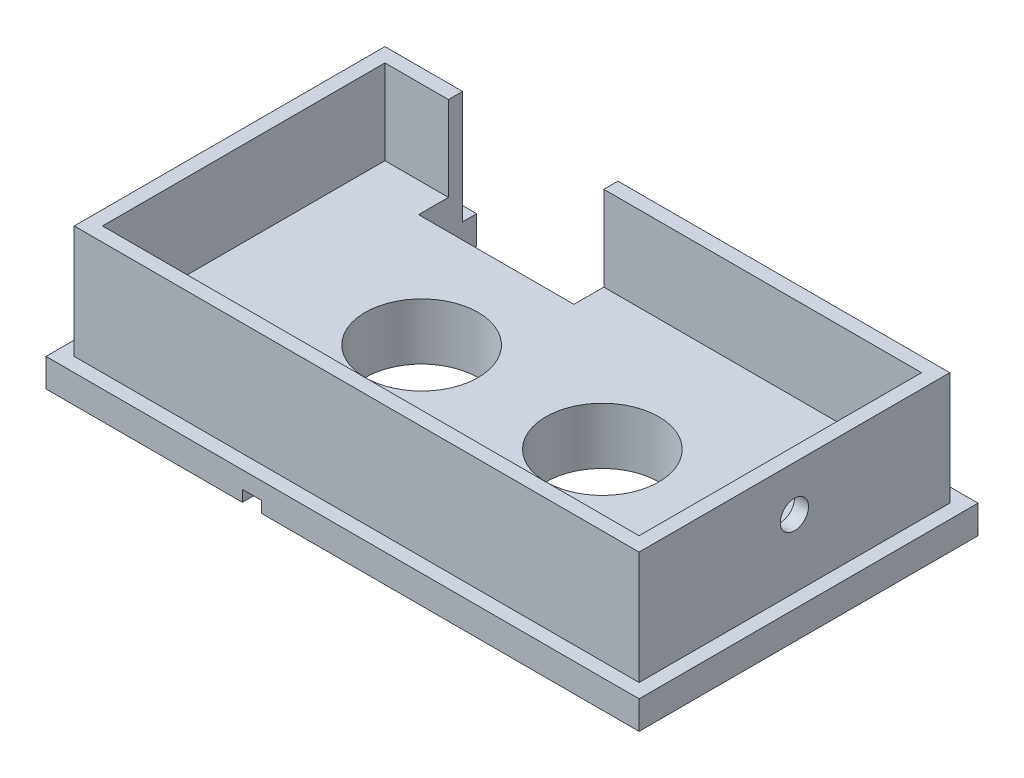
from build123d import *

# Parameters (mm, degrees)
SKETCH1_W           = 42
SKETCH1_H           = 24
BOSS_EXTRUDE1_DEPTH = 2
BOSS_EXTRUDE2_DEPTH = 8
CUT_EXTRUDE1_DEPTH  = 6
CUT_EXTRUDE2_REACH  = 51.396
SKETCH2_R           = 4
SKETCH3_W           = 3.111111111
SKETCH3_H           = 1.652777778
CUT_EXTRUDE3_DEPTH  = 0.8
CUT_EXTRUDE4_REACH  = 51.396
SKETCH4_W           = 11
SKETCH4_H           = 4.114457091
CUT_EXTRUDE5_REACH  = 50.549
SKETCH5_R           = 1


with BuildPart() as part:
    # Sketch1 → Boss-Extrude1 (new body)
    with BuildSketch(Plane(origin=(0, 0, 0), x_dir=(1, 0, 0), z_dir=(0, 1, 0))):
        with Locations((21, 12)):
            Rectangle(SKETCH1_W, SKETCH1_H)
    extrude(amount=BOSS_EXTRUDE1_DEPTH)

    # 3DSketch1 → Boss-Extrude2 (add)
    with BuildSketch(Plane(origin=(1, 2, -1), x_dir=(0.876215908676647, 0, -0.4819187497721558), z_dir=(0, -1, 0))):
        Polygon((0, 0), (35.048636347, 19.276749991), (45.650848842, 0), (10.602212495, -19.276749991), align=None)
    extrude(amount=-BOSS_EXTRUDE2_DEPTH)

    # 3DSketch2 → Cut-Extrude1 (cut)
    with BuildSketch(Plane(origin=(2, 10, -2), x_dir=(0.8849182223819825, 0, -0.4657464328326223), z_dir=(0, -1, 0))):
        Polygon((0, 0), (33.626892451, 17.698364448), (42.941821107, 0), (9.314928657, -17.698364448), align=None)
    extrude(amount=CUT_EXTRUDE1_DEPTH, mode=Mode.SUBTRACT)

    # Sketch2 → Cut-Extrude2 (cut, up to next)
    with BuildSketch(Plane.XZ, mode=Mode.PRIVATE) as cut_extrude2_sk1:
        with Locations(Location((27.4, -12, 0), (0, 0, 270))):
            Circle(SKETCH2_R)
    cut_extrude2_tool1 = extrude(cut_extrude2_sk1.sketch, amount=-CUT_EXTRUDE2_REACH, mode=Mode.PRIVATE) & part.part
    # Sketch2 → Cut-Extrude2 (cut, up to next)
    with BuildSketch(Plane.XZ, mode=Mode.PRIVATE) as cut_extrude2_sk2:
        with Locations(Location((14.6, -12, 0), (0, 0, 270))):
            Circle(SKETCH2_R)
    cut_extrude2_tool2 = extrude(cut_extrude2_sk2.sketch, amount=-CUT_EXTRUDE2_REACH, mode=Mode.PRIVATE) & part.part
    add(cut_extrude2_tool1.solids().sort_by_distance((27.4, 0, -12))[0], mode=Mode.SUBTRACT)
    add(cut_extrude2_tool2.solids().sort_by_distance((14.6, 0, -12))[0], mode=Mode.SUBTRACT)

    # Sketch3 → Cut-Extrude3 (cut)
    with BuildSketch(Plane.XZ):
        Polygon((13.902777778, -6.222222222), (15.263888889, -6.222222222), (15.263888889, -3.791666667), (17.597222222, -3.791666667), (17.597222222, -2.430555556), (15.263888889, -2.430555556), (15.263888889, 0), (13.902777778, 0), (13.902777778, -2.430555556), (11.569444444, -2.430555556), (11.569444444, -3.791666667), (13.902777778, -3.791666667), align=None)
        with Locations((27.611111112, -2.479166667)):
            Rectangle(SKETCH3_W, SKETCH3_H)
    extrude(amount=-CUT_EXTRUDE3_DEPTH, mode=Mode.SUBTRACT)

    # Sketch4 → Cut-Extrude4 (cut, up to next)
    with BuildSketch(Plane.XZ, mode=Mode.PRIVATE) as cut_extrude4_sk1:
        with Locations((12, -21.942771455)):
            Rectangle(SKETCH4_W, SKETCH4_H)
    cut_extrude4_tool1 = extrude(cut_extrude4_sk1.sketch, amount=-CUT_EXTRUDE4_REACH, mode=Mode.PRIVATE) & part.part
    add(cut_extrude4_tool1.solids().sort_by_distance((12, 0, -21.942771))[0], mode=Mode.SUBTRACT)

    # Sketch5 → Cut-Extrude5 (cut, up to next)
    with BuildSketch(Plane(origin=(41, 0, 0), x_dir=(0, 0, -1), z_dir=(1, 0, 0)), mode=Mode.PRIVATE) as cut_extrude5_sk1:
        with Locations((12, 6.8)):
            Circle(SKETCH5_R)
    cut_extrude5_tool1 = extrude(cut_extrude5_sk1.sketch, amount=-CUT_EXTRUDE5_REACH, mode=Mode.PRIVATE) & part.part
    add(cut_extrude5_tool1.solids().sort_by_distance((41, 6.8, -12))[0], mode=Mode.SUBTRACT)


solid = part.part
